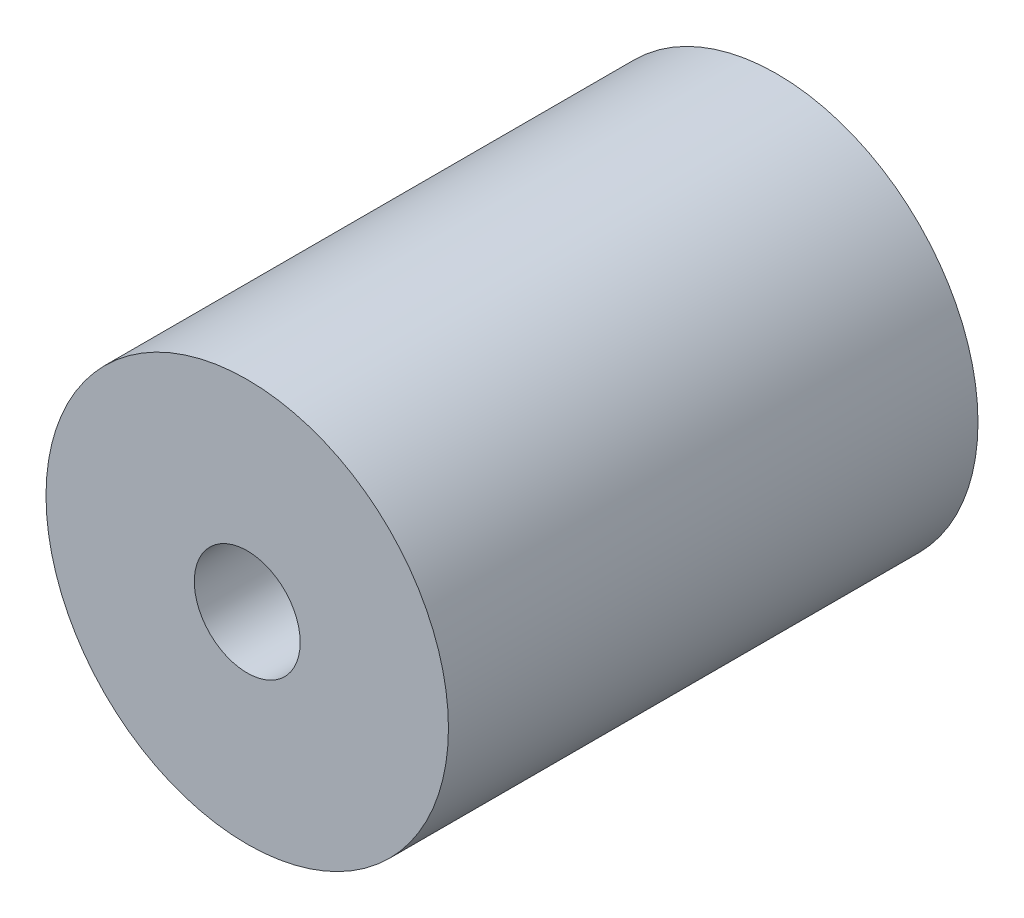
from build123d import *

# Parameters (mm, degrees)
SKETCH1_R           = 9.5
SKETCH1_R_2         = 4
BOSS_EXTRUDE1_DEPTH = 17.5
BOSS_EXTRUDE2_START = 7.5
SKETCH1_3_R         = 9.5
SKETCH1_3_R_2       = 2.5
BOSS_EXTRUDE2_DEPTH = 7.5


with BuildPart() as part:
    # Sketch1 → Boss-Extrude1 (new body)
    with BuildSketch(Plane.XY):
        Circle(SKETCH1_R)
        Circle(SKETCH1_R_2, mode=Mode.SUBTRACT)
    extrude(amount=-BOSS_EXTRUDE1_DEPTH)

    # Sketch1<3> → Boss-Extrude2 (add)
    with BuildSketch(Plane.XY.offset(BOSS_EXTRUDE2_START)):
        Circle(SKETCH1_3_R)
        Circle(SKETCH1_3_R_2, mode=Mode.SUBTRACT)
    extrude(amount=-BOSS_EXTRUDE2_DEPTH)


solid = part.part
